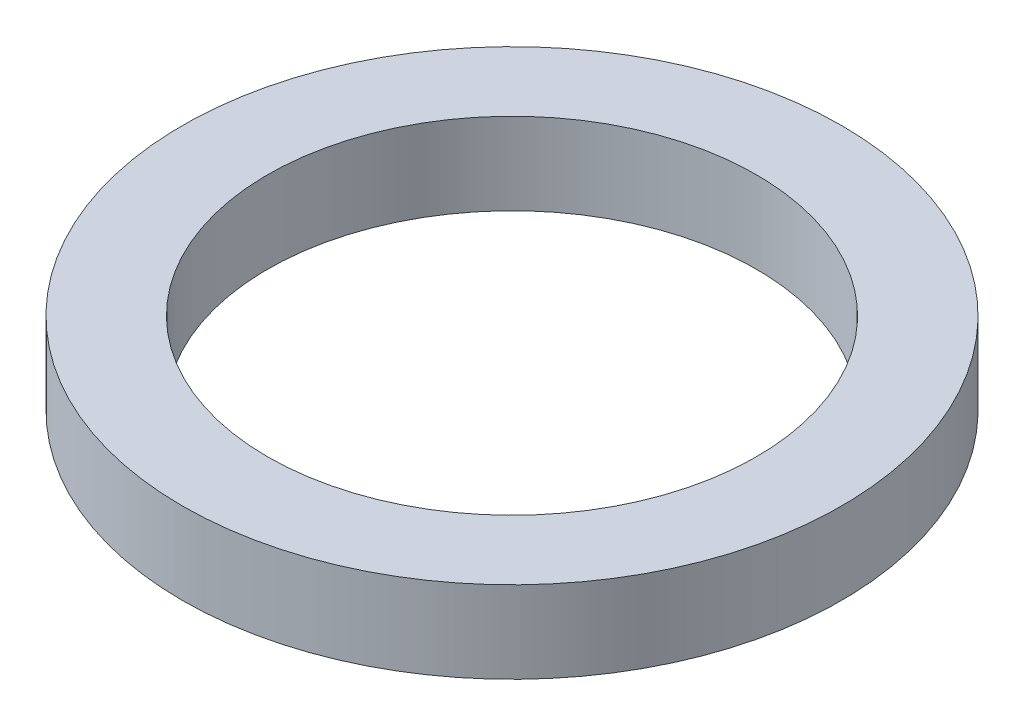
from build123d import *

# Parameters (mm, degrees)
SKETCH1_R   = 80.520596245
SKETCH1_R_2 = 59.705681816
BODY_DEPTH  = 20


with BuildPart() as part:
    # Sketch1 → body (new body)
    with BuildSketch(Plane(origin=(0, 0, 0), x_dir=(1, 0, 0), z_dir=(0, 1, 0))):
        with Locations(Location((0, 0, 0), (0, 0, 270))):
            Circle(SKETCH1_R)
        with Locations(Location((0, 0, 0), (0, 0, 270))):
            Circle(SKETCH1_R_2, mode=Mode.SUBTRACT)
    extrude(amount=BODY_DEPTH)


solid = part.part
